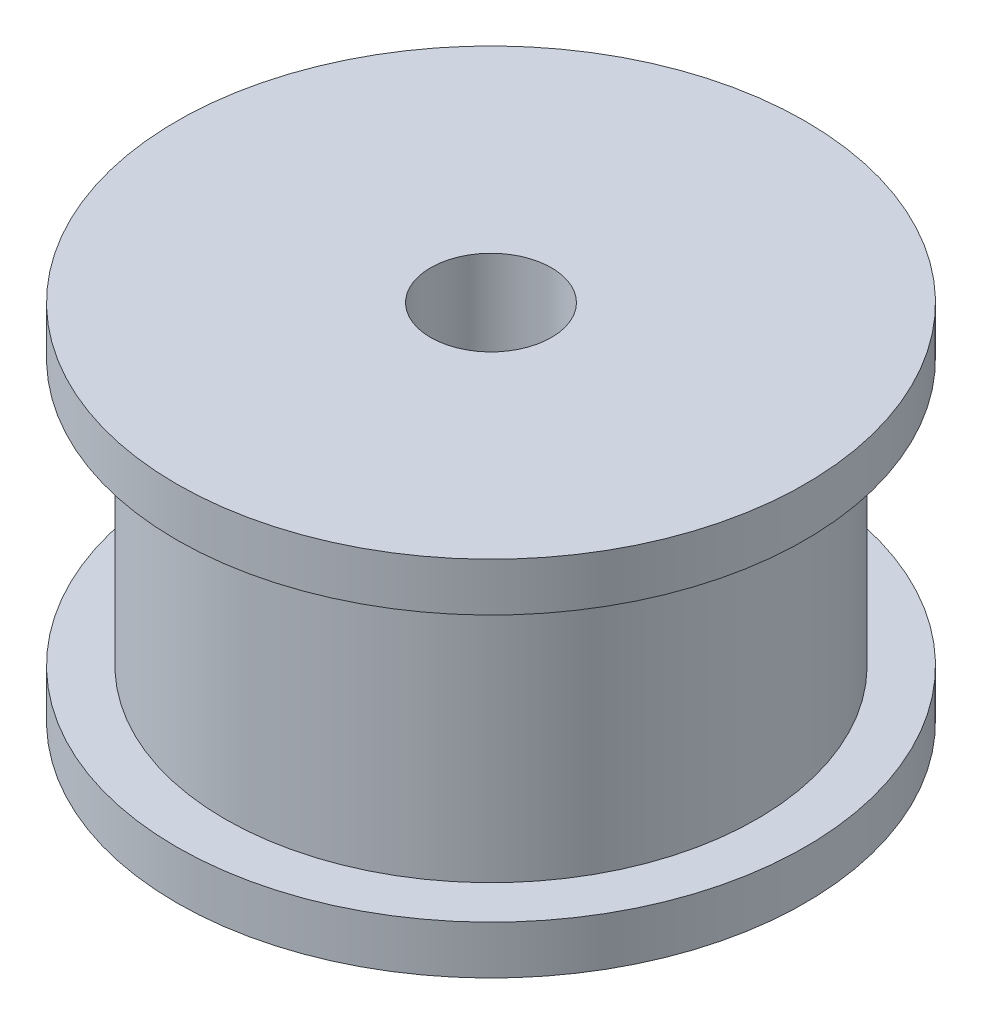
from build123d import *

# Parameters (mm, degrees)
SKETCH_1_R      = 13
EXTRUDE_1_DEPTH = 2
SKETCH_2_R      = 11
EXTRUDE_2_DEPTH = 11
SKETCH_3_R      = 13
EXTRUDE_3_DEPTH = 2
HOLE_WIZARD_1_D = 5


with BuildPart() as part:
    # 草图1 → 凸台-拉伸1 (new body)
    with BuildSketch(Plane(origin=(0, 0, 0), x_dir=(1, 0, 0), z_dir=(0, 1, 0))):
        with Locations(Location((0, 0, 0), (0, 0, 270))):
            Circle(SKETCH_1_R)
    extrude(amount=EXTRUDE_1_DEPTH)

    # 草图2 → 凸台-拉伸2 (add)
    with BuildSketch(Plane(origin=(0, 2, 0), x_dir=(1, 0, 0), z_dir=(0, 1, 0))):
        with Locations(Location((0, 0, 0), (0, 0, 270))):
            Circle(SKETCH_2_R)
    extrude(amount=EXTRUDE_2_DEPTH)

    # 草图3 → 凸台-拉伸3 (add)
    with BuildSketch(Plane(origin=(0, 13, 0), x_dir=(1, 0, 0), z_dir=(0, 1, 0))):
        with Locations(Location((0, 0, 0), (0, 0, 270))):
            Circle(SKETCH_3_R)
    extrude(amount=EXTRUDE_3_DEPTH)

    # 孔1 (through all)
    with Locations(Plane(origin=(0, 15, 0), x_dir=(1, 0, 0), z_dir=(0, 1, 0))):
        with Locations((0, 0)):
            Hole(HOLE_WIZARD_1_D / 2)


solid = part.part
